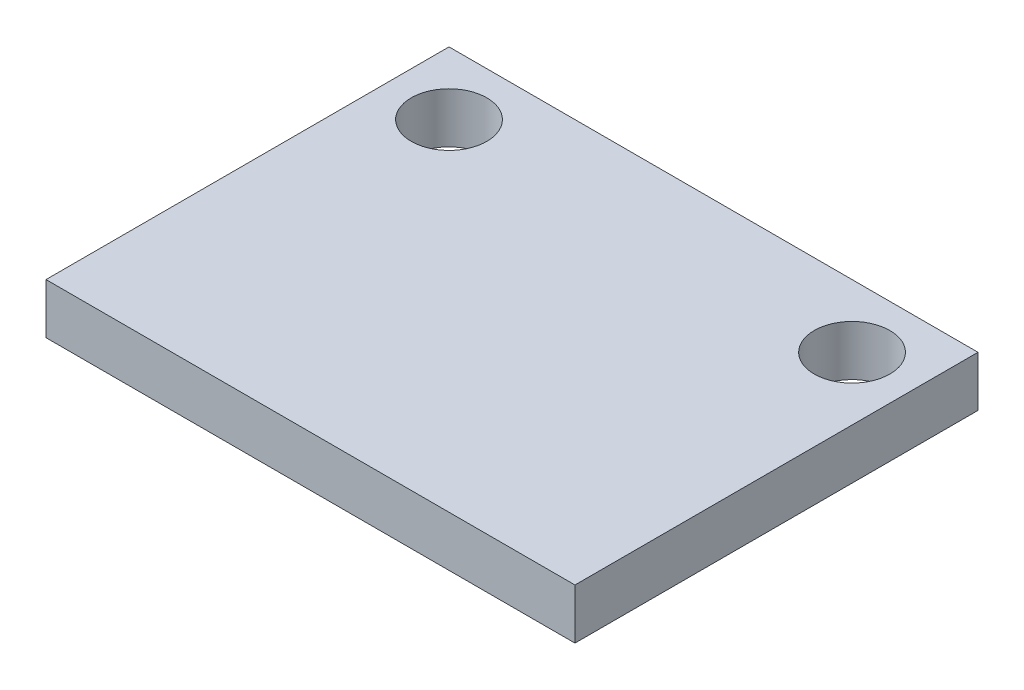
from build123d import *

# Parameters (mm, degrees)
SKETCH1_W           = 21
SKETCH1_H           = 16
SKETCH1_R           = 1.5
BOSS_EXTRUDE1_DEPTH = 2


with BuildPart() as part:
    # Sketch1 → Boss-Extrude1 (new body)
    with BuildSketch(Plane(origin=(0, 0, 0), x_dir=(1, 0, 0), z_dir=(0, 1, 0))):
        with Locations((10.5, -8)):
            Rectangle(SKETCH1_W, SKETCH1_H)
        with Locations(Location((2.5, -2.5, 0), (0, 0, 270))):
            Circle(SKETCH1_R, mode=Mode.SUBTRACT)
        with Locations(Location((18.5, -2.5, 0), (0, 0, 270))):
            Circle(SKETCH1_R, mode=Mode.SUBTRACT)
    extrude(amount=BOSS_EXTRUDE1_DEPTH)


solid = part.part
